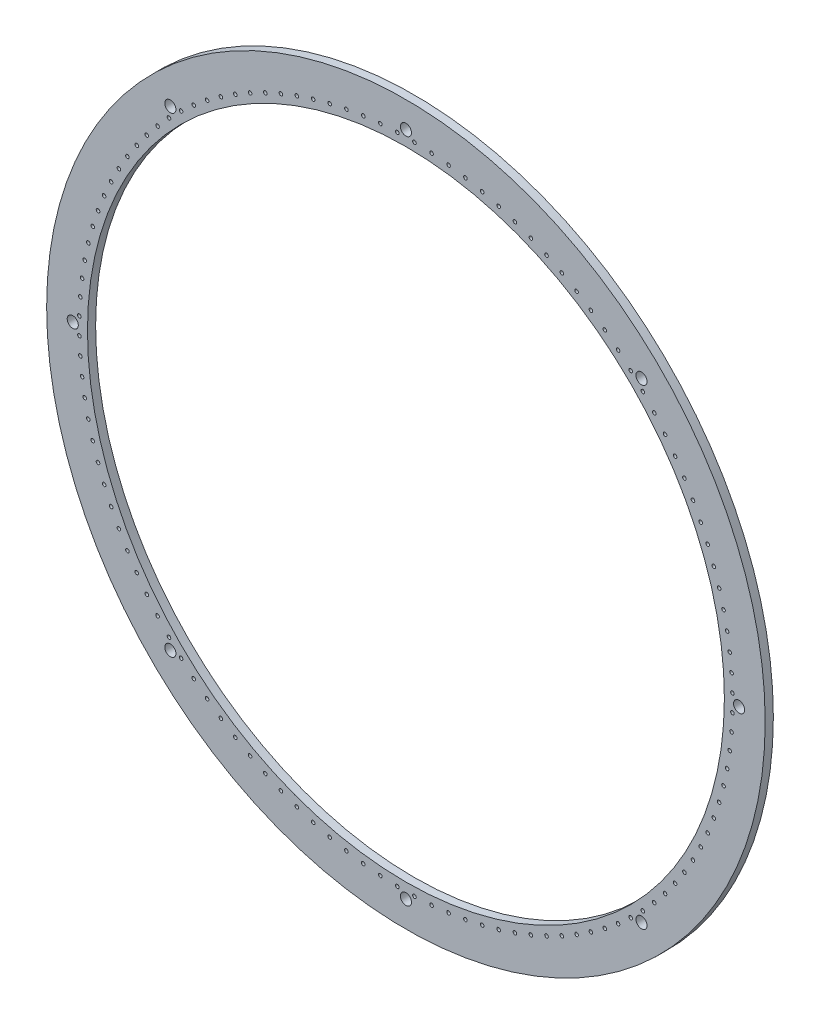
from build123d import *

# Parameters (mm, degrees)
SKETCH1_R           = 139.7
SKETCH1_R_2         = 0.6985
SKETCH1_R_3         = 2.159
SKETCH1_R_4         = 5.08
BOSS_EXTRUDE1_DEPTH = 3.175
SKETCH2_R           = 123.825
CUT_EXTRUDE1_DEPTH  = 353.710920054


with BuildPart() as part:
    # Sketch1 → Boss-Extrude1 (new body)
    with BuildSketch(Plane.XY):
        with Locations((184.15, 0)):
            Circle(SKETCH1_R)
        with Locations((96.728968887, -92.122545119)):
            Circle(SKETCH1_R_2, mode=Mode.SUBTRACT)
        with Locations((92.027454881, -87.421031113)):
            Circle(SKETCH1_R_2, mode=Mode.SUBTRACT)
        with Locations((92.551387565, -91.598612435)):
            Circle(SKETCH1_R_3, mode=Mode.SUBTRACT)
        with Locations((101.670097862, -96.571557631)):
            Circle(SKETCH1_R_2, mode=Mode.SUBTRACT)
        with Locations((106.837298516, -100.755874217)):
            Circle(SKETCH1_R_2, mode=Mode.SUBTRACT)
        with Locations((112.216407911, -104.664025955)):
            Circle(SKETCH1_R_2, mode=Mode.SUBTRACT)
        with Locations((87.578442369, -82.479902138)):
            Circle(SKETCH1_R_2, mode=Mode.SUBTRACT)
        with Locations((83.394125783, -77.312701484)):
            Circle(SKETCH1_R_2, mode=Mode.SUBTRACT)
        with Locations((79.485974045, -71.933592089)):
            Circle(SKETCH1_R_2, mode=Mode.SUBTRACT)
        with Locations((129.475090705, -114.628331112)):
            Circle(SKETCH1_R_2, mode=Mode.SUBTRACT)
        with Locations((117.792682281, -108.285300873)):
            Circle(SKETCH1_R_2, mode=Mode.SUBTRACT)
        with Locations((123.550837447, -111.609773308)):
            Circle(SKETCH1_R_2, mode=Mode.SUBTRACT)
        with Locations((135.54920409, -117.332700629)):
            Circle(SKETCH1_R_2, mode=Mode.SUBTRACT)
        with Locations((141.756528877, -119.715469369)):
            Circle(SKETCH1_R_2, mode=Mode.SUBTRACT)
        with Locations((148.080051223, -121.770106328)):
            Circle(SKETCH1_R_2, mode=Mode.SUBTRACT)
        with Locations((154.50243879, -123.490979891)):
            Circle(SKETCH1_R_2, mode=Mode.SUBTRACT)
        with Locations((161.006088262, -124.873373261)):
            Circle(SKETCH1_R_2, mode=Mode.SUBTRACT)
        with Locations((174.185694843, -126.608501384)):
            Circle(SKETCH1_R_2, mode=Mode.SUBTRACT)
        with Locations((167.573173588, -125.913497394)):
            Circle(SKETCH1_R_2, mode=Mode.SUBTRACT)
        with Locations((184.15, -129.54)):
            Circle(SKETCH1_R_3, mode=Mode.SUBTRACT)
        with Locations((180.825527565, -126.956480272)):
            Circle(SKETCH1_R_2, mode=Mode.SUBTRACT)
        with Locations((75.864699127, -66.357317719)):
            Circle(SKETCH1_R_2, mode=Mode.SUBTRACT)
        with Locations((69.521668888, -54.674909295)):
            Circle(SKETCH1_R_2, mode=Mode.SUBTRACT)
        with Locations((72.540226692, -60.599162553)):
            Circle(SKETCH1_R_2, mode=Mode.SUBTRACT)
        with Locations((66.817299371, -48.60079591)):
            Circle(SKETCH1_R_2, mode=Mode.SUBTRACT)
        with Locations((64.434530631, -42.393471123)):
            Circle(SKETCH1_R_2, mode=Mode.SUBTRACT)
        with Locations((62.379893672, -36.069948777)):
            Circle(SKETCH1_R_2, mode=Mode.SUBTRACT)
        with Locations((60.659020109, -29.64756121)):
            Circle(SKETCH1_R_2, mode=Mode.SUBTRACT)
        with Locations((59.276626739, -23.143911738)):
            Circle(SKETCH1_R_2, mode=Mode.SUBTRACT)
        with Locations((58.236502606, -16.576826412)):
            Circle(SKETCH1_R_2, mode=Mode.SUBTRACT)
        with Locations((57.541498616, -9.964305157)):
            Circle(SKETCH1_R_2, mode=Mode.SUBTRACT)
        with BuildLine():
            ThreePointArc((57.892019728, -3.324472435), (56.49507957, -3.333615518), (57.89178037, -3.306187837))
            ThreePointArc((57.89178037, -3.306187837), (57.891959886, -3.315329353), (57.892019728, -3.324472435))
        make_face(mode=Mode.SUBTRACT)
        with Locations((187.474472435, -126.956480272)):
            Circle(SKETCH1_R_2, mode=Mode.SUBTRACT)
        with Locations((194.114305157, -126.608501384)):
            Circle(SKETCH1_R_2, mode=Mode.SUBTRACT)
        with Locations((200.726826412, -125.913497394)):
            Circle(SKETCH1_R_2, mode=Mode.SUBTRACT)
        with Locations((207.293911738, -124.873373261)):
            Circle(SKETCH1_R_2, mode=Mode.SUBTRACT)
        with Locations((213.79756121, -123.490979891)):
            Circle(SKETCH1_R_2, mode=Mode.SUBTRACT)
        with Locations((220.219948777, -121.770106328)):
            Circle(SKETCH1_R_2, mode=Mode.SUBTRACT)
        with Locations((226.543471123, -119.715469369)):
            Circle(SKETCH1_R_2, mode=Mode.SUBTRACT)
        with Locations((232.75079591, -117.332700629)):
            Circle(SKETCH1_R_2, mode=Mode.SUBTRACT)
        with Locations((238.824909295, -114.628331112)):
            Circle(SKETCH1_R_2, mode=Mode.SUBTRACT)
        with Locations((244.749162553, -111.609773308)):
            Circle(SKETCH1_R_2, mode=Mode.SUBTRACT)
        with Locations((250.507317719, -108.285300873)):
            Circle(SKETCH1_R_2, mode=Mode.SUBTRACT)
        with Locations((256.083592089, -104.664025955)):
            Circle(SKETCH1_R_2, mode=Mode.SUBTRACT)
        with Locations((261.462701484, -100.755874217)):
            Circle(SKETCH1_R_2, mode=Mode.SUBTRACT)
        with Locations((266.629902138, -96.571557631)):
            Circle(SKETCH1_R_2, mode=Mode.SUBTRACT)
        with Locations((271.571031113, -92.122545119)):
            Circle(SKETCH1_R_2, mode=Mode.SUBTRACT)
        with Locations((275.748612435, -91.598612435)):
            Circle(SKETCH1_R_3, mode=Mode.SUBTRACT)
        with Locations((276.272545119, -87.421031113)):
            Circle(SKETCH1_R_2, mode=Mode.SUBTRACT)
        with Locations((280.721557631, -82.479902138)):
            Circle(SKETCH1_R_2, mode=Mode.SUBTRACT)
        with Locations((284.905874217, -77.312701484)):
            Circle(SKETCH1_R_2, mode=Mode.SUBTRACT)
        with Locations((288.814025955, -71.933592089)):
            Circle(SKETCH1_R_2, mode=Mode.SUBTRACT)
        with BuildLine():
            ThreePointArc((198.875135135, -122.946333903), (193.905300017, -121.39100464), (191.77, -116.641393703))
            Line((191.77, -116.641393703), (191.77, -17.285535138))
            Line((191.77, -17.285535138), (191.77, -13.926637247))
            ThreePointArc((191.77, -13.926637247), (192.984669885, -13.189550145), (194.128571429, -12.346810813))
            ThreePointArc((194.128571429, -12.346810813), (195.375320151, -11.225320151), (196.496810813, -9.978571429))
            ThreePointArc((196.496810813, -9.978571429), (198.699029284, -8.239900898), (201.435535138, -7.62))
            Line((201.435535138, -7.62), (300.791393703, -7.62))
            ThreePointArc((300.791393703, -7.62), (305.54100464, -9.755300017), (307.096333903, -14.725135135))
            ThreePointArc((307.096333903, -14.725135135), (271.70749718, -87.55749718), (198.875135135, -122.946333903))
        make_face(mode=Mode.SUBTRACT)
        with BuildLine():
            Line((182.941381345, -9.078964309), (182.941381345, -7.078964309))
            ThreePointArc((182.941381345, -7.078964309), (184.191381345, -5.828964309), (185.441381345, -7.078964309))
            Line((185.441381345, -7.078964309), (185.441381345, -9.078964309))
            ThreePointArc((185.441381345, -9.078964309), (184.191381345, -10.328964309), (182.941381345, -9.078964309))
        make_face(mode=Mode.SUBTRACT)
        with Locations((292.435300873, -66.357317719)):
            Circle(SKETCH1_R_2, mode=Mode.SUBTRACT)
        with Locations((295.759773308, -60.599162553)):
            Circle(SKETCH1_R_2, mode=Mode.SUBTRACT)
        with Locations((298.778331112, -54.674909295)):
            Circle(SKETCH1_R_2, mode=Mode.SUBTRACT)
        with Locations((301.482700629, -48.60079591)):
            Circle(SKETCH1_R_2, mode=Mode.SUBTRACT)
        with Locations((303.865469369, -42.393471123)):
            Circle(SKETCH1_R_2, mode=Mode.SUBTRACT)
        with Locations((305.920106328, -36.069948777)):
            Circle(SKETCH1_R_2, mode=Mode.SUBTRACT)
        with Locations((307.640979891, -29.64756121)):
            Circle(SKETCH1_R_2, mode=Mode.SUBTRACT)
        with Locations((309.023373261, -23.143911738)):
            Circle(SKETCH1_R_2, mode=Mode.SUBTRACT)
        with Locations((310.063497394, -16.576826412)):
            Circle(SKETCH1_R_2, mode=Mode.SUBTRACT)
        with Locations((310.758501384, -9.964305157)):
            Circle(SKETCH1_R_2, mode=Mode.SUBTRACT)
        with Locations((311.106480272, -3.324472435)):
            Circle(SKETCH1_R_2, mode=Mode.SUBTRACT)
        with Locations((54.61, 0)):
            Circle(SKETCH1_R_3, mode=Mode.SUBTRACT)
        with Locations((57.193519728, 3.324472435)):
            Circle(SKETCH1_R_2, mode=Mode.SUBTRACT)
        with Locations((57.541498616, 9.964305157)):
            Circle(SKETCH1_R_2, mode=Mode.SUBTRACT)
        with Locations((58.236502606, 16.576826412)):
            Circle(SKETCH1_R_2, mode=Mode.SUBTRACT)
        with Locations((59.276626739, 23.143911738)):
            Circle(SKETCH1_R_2, mode=Mode.SUBTRACT)
        with Locations((60.659020109, 29.64756121)):
            Circle(SKETCH1_R_2, mode=Mode.SUBTRACT)
        with Locations((62.379893672, 36.069948777)):
            Circle(SKETCH1_R_2, mode=Mode.SUBTRACT)
        with Locations((64.434530631, 42.393471123)):
            Circle(SKETCH1_R_2, mode=Mode.SUBTRACT)
        with Locations((66.817299371, 48.60079591)):
            Circle(SKETCH1_R_2, mode=Mode.SUBTRACT)
        with Locations((69.521668888, 54.674909295)):
            Circle(SKETCH1_R_2, mode=Mode.SUBTRACT)
        with Locations((72.540226692, 60.599162553)):
            Circle(SKETCH1_R_2, mode=Mode.SUBTRACT)
        with Locations((75.864699127, 66.357317719)):
            Circle(SKETCH1_R_2, mode=Mode.SUBTRACT)
        with BuildLine():
            Line((176.53, -17.285535138), (176.53, -116.641393703))
            ThreePointArc((176.53, -116.641393703), (174.394699983, -121.39100464), (169.424864865, -122.946333903))
            ThreePointArc((169.424864865, -122.946333903), (92.61631149, -83.39193302), (60.367431735, -3.241360624))
            ThreePointArc((60.367431735, -3.241360624), (60.335608388, -1.620819172), (60.325, 0))
            ThreePointArc((60.325, 0), (91.532586726, 82.186649667), (169.424864865, 122.946333903))
            ThreePointArc((169.424864865, 122.946333903), (174.394699983, 121.39100464), (176.53, 116.641393703))
            Line((176.53, 116.641393703), (176.53, 17.285535138))
            ThreePointArc((176.53, 17.285535138), (175.910099102, 14.549029284), (174.171428571, 12.346810813))
            ThreePointArc((174.171428571, 12.346810813), (168.275, 0), (174.171428571, -12.346810813))
            ThreePointArc((174.171428571, -12.346810813), (175.910099102, -14.549029284), (176.53, -17.285535138))
        make_face(mode=Mode.SUBTRACT)
        with BuildLine():
            Line((173.691383345, 1.25), (175.608616655, 1.25))
            ThreePointArc((175.608616655, 1.25), (176.858616655, 0), (175.608616655, -1.25))
            Line((175.608616655, -1.25), (173.691383345, -1.25))
            ThreePointArc((173.691383345, -1.25), (172.441383345, 0), (173.691383345, 1.25))
        make_face(mode=Mode.SUBTRACT)
        with Locations((79.485974045, 71.933592089)):
            Circle(SKETCH1_R_2, mode=Mode.SUBTRACT)
        with Locations((83.394125783, 77.312701484)):
            Circle(SKETCH1_R_2, mode=Mode.SUBTRACT)
        with Locations((87.578442369, 82.479902138)):
            Circle(SKETCH1_R_2, mode=Mode.SUBTRACT)
        with Locations((92.027454881, 87.421031113)):
            Circle(SKETCH1_R_2, mode=Mode.SUBTRACT)
        with Locations((92.551387565, 91.598612435)):
            Circle(SKETCH1_R_3, mode=Mode.SUBTRACT)
        with Locations((96.728968887, 92.122545119)):
            Circle(SKETCH1_R_2, mode=Mode.SUBTRACT)
        with Locations((101.670097862, 96.571557631)):
            Circle(SKETCH1_R_2, mode=Mode.SUBTRACT)
        with Locations((106.837298516, 100.755874217)):
            Circle(SKETCH1_R_2, mode=Mode.SUBTRACT)
        with Locations((112.216407911, 104.664025955)):
            Circle(SKETCH1_R_2, mode=Mode.SUBTRACT)
        with Locations((117.792682281, 108.285300873)):
            Circle(SKETCH1_R_2, mode=Mode.SUBTRACT)
        with Locations((123.550837447, 111.609773308)):
            Circle(SKETCH1_R_2, mode=Mode.SUBTRACT)
        with Locations((129.475090705, 114.628331112)):
            Circle(SKETCH1_R_2, mode=Mode.SUBTRACT)
        with Locations((135.54920409, 117.332700629)):
            Circle(SKETCH1_R_2, mode=Mode.SUBTRACT)
        with Locations((141.756528877, 119.715469369)):
            Circle(SKETCH1_R_2, mode=Mode.SUBTRACT)
        with Locations((148.080051223, 121.770106328)):
            Circle(SKETCH1_R_2, mode=Mode.SUBTRACT)
        with Locations((154.50243879, 123.490979891)):
            Circle(SKETCH1_R_2, mode=Mode.SUBTRACT)
        with Locations((161.006088262, 124.873373261)):
            Circle(SKETCH1_R_2, mode=Mode.SUBTRACT)
        with Locations((167.573173588, 125.913497394)):
            Circle(SKETCH1_R_2, mode=Mode.SUBTRACT)
        with Locations((174.185694843, 126.608501384)):
            Circle(SKETCH1_R_2, mode=Mode.SUBTRACT)
        with Locations((180.825527565, 126.956480272)):
            Circle(SKETCH1_R_2, mode=Mode.SUBTRACT)
        with Locations((184.15, 0)):
            Circle(SKETCH1_R_4, mode=Mode.SUBTRACT)
        with BuildLine():
            Line((185.4, 8.920928665), (185.4, 6.921035691))
            ThreePointArc((185.4, 6.921035691), (184.15, 5.671035691), (182.9, 6.921035691))
            Line((182.9, 6.921035691), (182.9, 8.920928665))
            ThreePointArc((182.9, 8.920928665), (184.15, 10.170928665), (185.4, 8.920928665))
        make_face(mode=Mode.SUBTRACT)
        with BuildLine():
            ThreePointArc((194.608616655, 1.25), (195.858616655, 0), (194.608616655, -1.25))
            Line((194.608616655, -1.25), (192.691383345, -1.25))
            ThreePointArc((192.691383345, -1.25), (192.188094477, -1.144202917), (191.77, -0.844720505))
            ThreePointArc((191.77, -0.844720505), (191.441383345, 0), (191.77, 0.844720505))
            ThreePointArc((191.77, 0.844720505), (192.188094477, 1.144202917), (192.691383345, 1.25))
            Line((192.691383345, 1.25), (194.608616655, 1.25))
        make_face(mode=Mode.SUBTRACT)
        with BuildLine():
            ThreePointArc((307.096333903, 14.725135135), (305.54100464, 9.755300017), (300.791393703, 7.62))
            Line((300.791393703, 7.62), (201.435535138, 7.62))
            ThreePointArc((201.435535138, 7.62), (198.699029284, 8.239900898), (196.496810813, 9.978571429))
            ThreePointArc((196.496810813, 9.978571429), (195.375320151, 11.225320151), (194.128571429, 12.346810813))
            ThreePointArc((194.128571429, 12.346810813), (192.389900898, 14.549029284), (191.77, 17.285535138))
            Line((191.77, 17.285535138), (191.77, 116.641393703))
            ThreePointArc((191.77, 116.641393703), (193.905300017, 121.39100464), (198.875135135, 122.946333903))
            ThreePointArc((198.875135135, 122.946333903), (271.70749718, 87.55749718), (307.096333903, 14.725135135))
        make_face(mode=Mode.SUBTRACT)
        with Locations((313.69, 0)):
            Circle(SKETCH1_R_3, mode=Mode.SUBTRACT)
        with Locations((311.106480272, 3.324472435)):
            Circle(SKETCH1_R_2, mode=Mode.SUBTRACT)
        with Locations((310.758501384, 9.964305157)):
            Circle(SKETCH1_R_2, mode=Mode.SUBTRACT)
        with Locations((310.063497394, 16.576826412)):
            Circle(SKETCH1_R_2, mode=Mode.SUBTRACT)
        with Locations((309.023373261, 23.143911738)):
            Circle(SKETCH1_R_2, mode=Mode.SUBTRACT)
        with Locations((307.640979891, 29.64756121)):
            Circle(SKETCH1_R_2, mode=Mode.SUBTRACT)
        with Locations((305.920106328, 36.069948777)):
            Circle(SKETCH1_R_2, mode=Mode.SUBTRACT)
        with Locations((303.865469369, 42.393471123)):
            Circle(SKETCH1_R_2, mode=Mode.SUBTRACT)
        with Locations((301.482700629, 48.60079591)):
            Circle(SKETCH1_R_2, mode=Mode.SUBTRACT)
        with Locations((295.759773308, 60.599162553)):
            Circle(SKETCH1_R_2, mode=Mode.SUBTRACT)
        with Locations((298.778331112, 54.674909295)):
            Circle(SKETCH1_R_2, mode=Mode.SUBTRACT)
        with Locations((292.435300873, 66.357317719)):
            Circle(SKETCH1_R_2, mode=Mode.SUBTRACT)
        with Locations((187.474472435, 126.956480272)):
            Circle(SKETCH1_R_2, mode=Mode.SUBTRACT)
        with Locations((184.15, 129.54)):
            Circle(SKETCH1_R_3, mode=Mode.SUBTRACT)
        with Locations((200.726826412, 125.913497394)):
            Circle(SKETCH1_R_2, mode=Mode.SUBTRACT)
        with Locations((194.114305157, 126.608501384)):
            Circle(SKETCH1_R_2, mode=Mode.SUBTRACT)
        with Locations((207.293911738, 124.873373261)):
            Circle(SKETCH1_R_2, mode=Mode.SUBTRACT)
        with Locations((213.79756121, 123.490979891)):
            Circle(SKETCH1_R_2, mode=Mode.SUBTRACT)
        with Locations((220.219948777, 121.770106328)):
            Circle(SKETCH1_R_2, mode=Mode.SUBTRACT)
        with Locations((226.543471123, 119.715469369)):
            Circle(SKETCH1_R_2, mode=Mode.SUBTRACT)
        with Locations((232.75079591, 117.332700629)):
            Circle(SKETCH1_R_2, mode=Mode.SUBTRACT)
        with Locations((244.749162553, 111.609773308)):
            Circle(SKETCH1_R_2, mode=Mode.SUBTRACT)
        with Locations((250.507317719, 108.285300873)):
            Circle(SKETCH1_R_2, mode=Mode.SUBTRACT)
        with Locations((238.824909295, 114.628331112)):
            Circle(SKETCH1_R_2, mode=Mode.SUBTRACT)
        with Locations((288.814025955, 71.933592089)):
            Circle(SKETCH1_R_2, mode=Mode.SUBTRACT)
        with Locations((284.905874217, 77.312701484)):
            Circle(SKETCH1_R_2, mode=Mode.SUBTRACT)
        with Locations((280.721557631, 82.479902138)):
            Circle(SKETCH1_R_2, mode=Mode.SUBTRACT)
        with Locations((256.083592089, 104.664025955)):
            Circle(SKETCH1_R_2, mode=Mode.SUBTRACT)
        with Locations((261.462701484, 100.755874217)):
            Circle(SKETCH1_R_2, mode=Mode.SUBTRACT)
        with Locations((266.629902138, 96.571557631)):
            Circle(SKETCH1_R_2, mode=Mode.SUBTRACT)
        with Locations((275.748612435, 91.598612435)):
            Circle(SKETCH1_R_3, mode=Mode.SUBTRACT)
        with Locations((276.272545119, 87.421031113)):
            Circle(SKETCH1_R_2, mode=Mode.SUBTRACT)
        with Locations((271.571031113, 92.122545119)):
            Circle(SKETCH1_R_2, mode=Mode.SUBTRACT)
    extrude(amount=BOSS_EXTRUDE1_DEPTH)

    # Sketch2 → Cut-Extrude1 (cut, through all)
    with BuildSketch(Plane.XY.offset(3.175)):
        with Locations((184.15, 0)):
            Circle(SKETCH2_R)
    extrude(amount=-CUT_EXTRUDE1_DEPTH, mode=Mode.SUBTRACT)


solid = part.part
